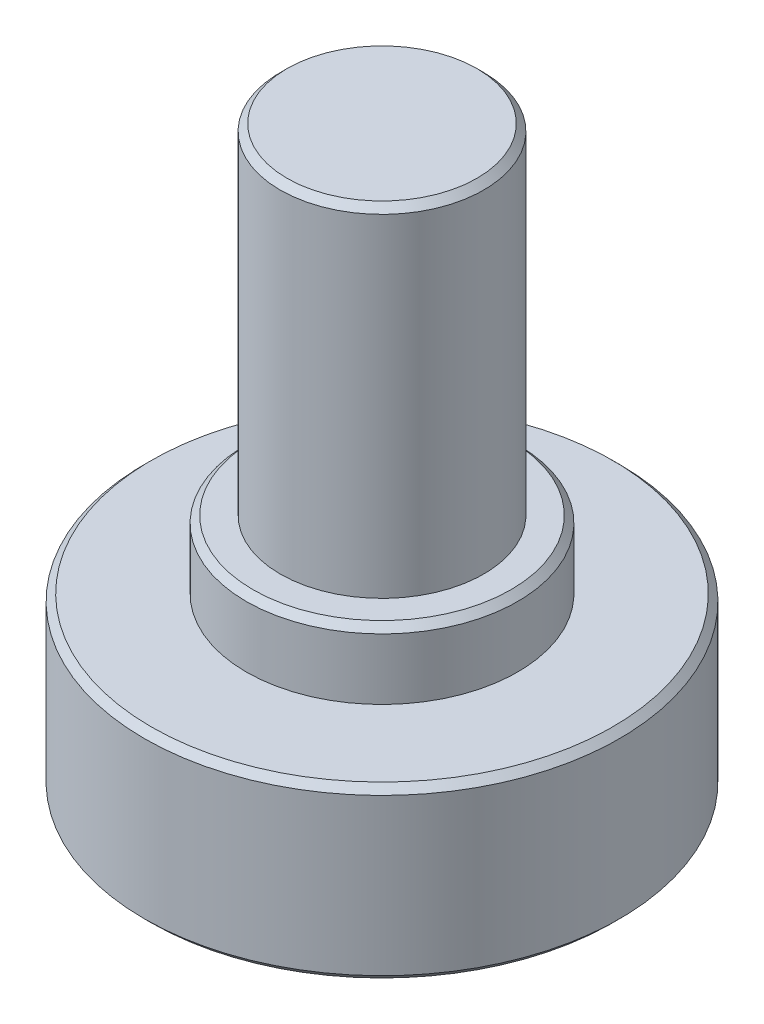
from build123d import *

# Parameters (mm, degrees)
SKETCH_1_R          = 7
EXTRUDE_1_DEPTH     = 5
SKETCH_2_R          = 4
EXTRUDE_2_DEPTH     = 2
SKETCH_3_R          = 3
EXTRUDE_3_DEPTH     = 10
CHAMFER_1_SIZE      = 0.2
CUT_EXTRUDE_1_DEPTH = 2.5


with BuildPart() as part:
    # 草图1 → 凸台-拉伸1 (new body)
    with BuildSketch(Plane(origin=(0, 0, 0), x_dir=(1, 0, 0), z_dir=(0, 1, 0))):
        with Locations(Location((0, 0, 0), (0, 0, 270))):
            Circle(SKETCH_1_R)
    extrude(amount=EXTRUDE_1_DEPTH)

    # 草图2 → 凸台-拉伸2 (add)
    with BuildSketch(Plane(origin=(0, 5, 0), x_dir=(1, 0, 0), z_dir=(0, 1, 0))):
        with Locations(Location((0, 0, 0), (0, 0, 270))):
            Circle(SKETCH_2_R)
    extrude(amount=EXTRUDE_2_DEPTH)

    # 草图3 → 凸台-拉伸3 (add)
    with BuildSketch(Plane(origin=(0, 7, 0), x_dir=(1, 0, 0), z_dir=(0, 1, 0))):
        with Locations(Location((0, 0, 0), (0, 0, 270))):
            Circle(SKETCH_3_R)
    extrude(amount=EXTRUDE_3_DEPTH)

    # 倒角1
    chamfer_1_edges = [part.edges().sort_by_distance(p)[0] for p in [
        (0, 17, -3),
        (0, 0, -7),
        (0, 5, -7),
        (0, 7, -4),
    ]]
    chamfer(chamfer_1_edges, length=CHAMFER_1_SIZE)

    # 草图4 → 切除-拉伸1 (cut)
    with BuildSketch(Plane.XZ):
        Polygon((2.886751346, 0), (1.443375673, 2.5), (-1.443375673, 2.5), (-2.886751346, 0), (-1.443375673, -2.5), (1.443375673, -2.5), align=None)
    extrude(amount=-CUT_EXTRUDE_1_DEPTH, mode=Mode.SUBTRACT)


solid = part.part
